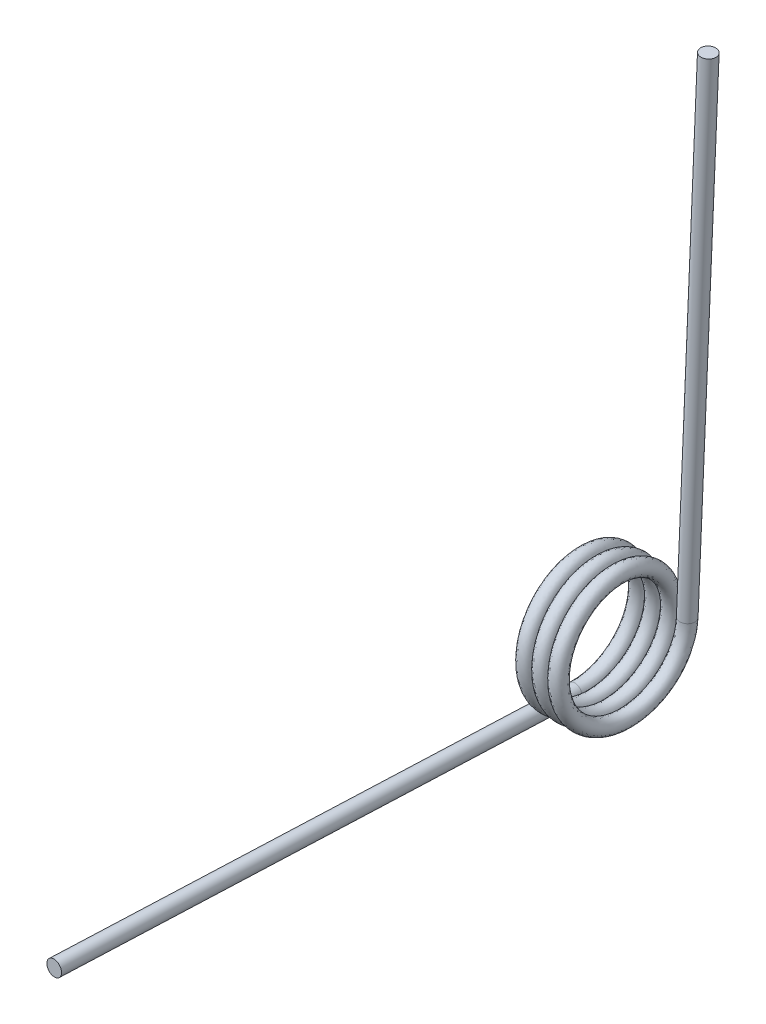
from build123d import *

# Parameters (mm, degrees)
SWEEP1_PITCH       = 0.6096
SWEEP1_HEIGHT      = 1.9812
SWEEP1_RADIUS      = 2.2987
SWEEP1_START_ANGLE = 90
SKETCH2_R          = 0.2921
SKETCH3_R          = 0.2921
EXTRUDE1_DEPTH     = 19.05
SKETCH4_R          = 0.2921
EXTRUDE2_DEPTH     = 19.05


with BuildPart() as part:
    # Sweep1: sweep along a helix
    with BuildLine() as sweep1_path:
        add(Helix(SWEEP1_PITCH, SWEEP1_HEIGHT, SWEEP1_RADIUS, center=(0, 0, 0), direction=(1, 0, 0), mode=Mode.PRIVATE).rotate(Axis((0, 0, 0), (1, 0, 0)), SWEEP1_START_ANGLE))
    # Sketch2 → Sweep1 (sweep)
    with BuildSketch(Plane(origin=(0, -2.2987, 0), x_dir=(0.995121779995382, 0.08926681293390738, 0.0420009415066539), z_dir=(0.04216929190356524, 1.1374581831979924e-14, -0.9991104797870715))):
        Circle(SKETCH2_R)
    sweep(path=sweep1_path.line, is_frenet=True)

    # Sketch3 → Extrude1 (add)
    with BuildSketch(Plane(origin=(0, 0, 0), x_dir=(-0.995121779995382, -0.08926681293390738, -0.0420009415066539), z_dir=(-0.04216929190356524, -1.1375449193717913e-14, 0.9991104797870715))):
        with Locations(Location((0.205197623, 2.289523013, 0), (0, 0, 354.87857121))):
            Circle(SKETCH3_R)
    extrude(amount=EXTRUDE1_DEPTH)

    # Sketch4 → Extrude2 (add)
    with BuildSketch(Plane(origin=(0.003523067, 0.083471485, 0), x_dir=(0.9951217799953831, -0.042000941506648015, -0.08926681293389828), z_dir=(0.04216929190356523, 0.9991104797870713, 5.494996818677933e-14))):
        with Locations(Location((2.176732893, 2.112824919, 0), (0, 0, 174.87857121))):
            Circle(SKETCH4_R)
    extrude(amount=EXTRUDE2_DEPTH)


solid = part.part
